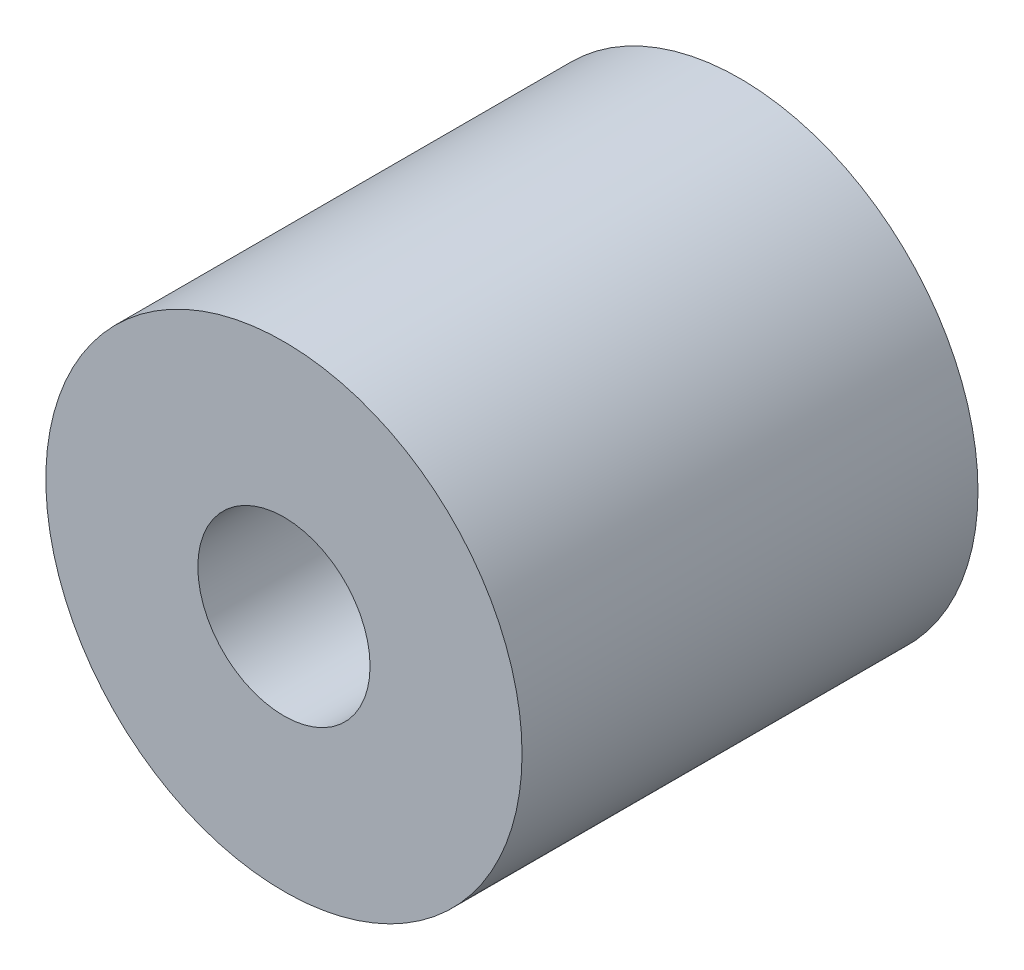
from build123d import *

# Parameters (mm, degrees)
SKETCH1_R           = 4.7
SKETCH1_R_2         = 1.7
BOSS_EXTRUDE1_DEPTH = 9


with BuildPart() as part:
    # Sketch1 → Boss-Extrude1 (new body)
    with BuildSketch(Plane.XY):
        Circle(SKETCH1_R)
        Circle(SKETCH1_R_2, mode=Mode.SUBTRACT)
    extrude(amount=BOSS_EXTRUDE1_DEPTH)


solid = part.part
